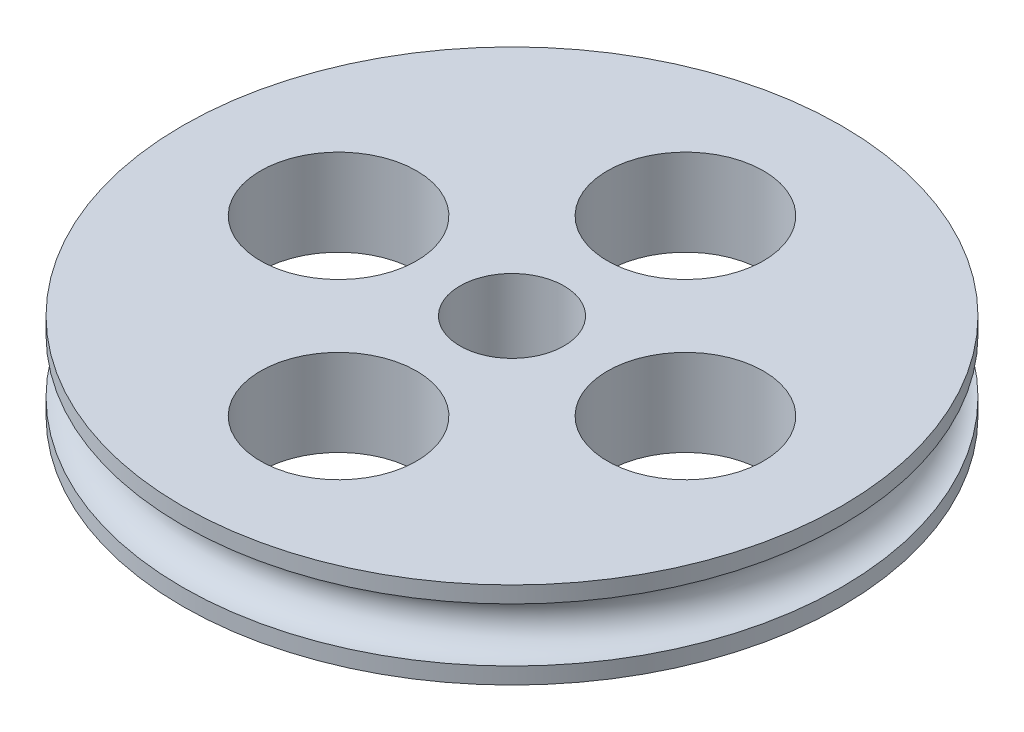
from build123d import *

# Parameters (mm, degrees)
ESQUISSE2_R             = 4.5
ENL_V_MAT_EXTRU_1_DEPTH = 28.331300737


with BuildPart() as part:
    # Esquisse1 → Révolution1 (revolve)
    with BuildSketch(Plane.XY, mode=Mode.PRIVATE) as r_volution1_sk:
        with BuildLine():
            Line((-19, 0), (-3, 0))
            Line((-3, 0), (-3, 5))
            Line((-3, 5), (-19, 5))
            Line((-19, 5), (-19, 4.05))
            ThreePointArc((-19, 4.05), (-17.45, 2.5), (-19, 0.95))
            Line((-19, 0.95), (-19, 0))
        make_face()
    revolve(r_volution1_sk.sketch.rotate(Axis((0, 0, 0), (0, 1, 0)), 270), axis=Axis((0, 0, 0), (0, 1, 0)))

    # Esquisse2 → Enlèv. mat.-Extru.1 (cut, through all)
    with BuildSketch(Plane(origin=(0, 0, 0), x_dir=(-1, 0, 0), z_dir=(0, -1, 0))):
        with Locations(Location((0, -10, 0), (0, 0, 90))):
            Circle(ESQUISSE2_R)
        with Locations(Location((-10, 0, 0), (0, 0, 90))):
            Circle(ESQUISSE2_R)
        with Locations(Location((0, 10, 0), (0, 0, 90))):
            Circle(ESQUISSE2_R)
        with Locations(Location((10, 0, 0), (0, 0, 90))):
            Circle(ESQUISSE2_R)
    extrude(amount=-ENL_V_MAT_EXTRU_1_DEPTH, mode=Mode.SUBTRACT)


solid = part.part
